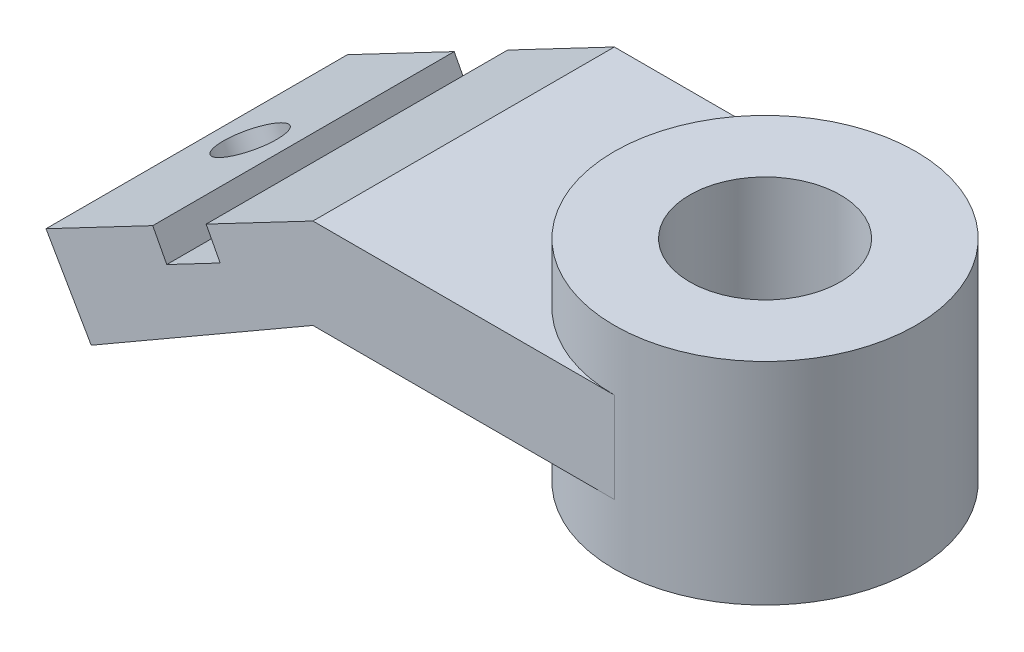
from build123d import *

# Parameters (mm, degrees)
SKETCH1_R           = 25
SKETCH1_R_2         = 12.5
BOSS_EXTRUDE1_DEPTH = 17.5
BOSS_EXTRUDE2_DEPTH = 25
CUT_EXTRUDE1_START  = -50
SKETCH3_R           = 12.5
CUT_EXTRUDE1_DEPTH  = 50
BOSS_EXTRUDE3_DEPTH = 25
SKETCH5_W           = 10
SKETCH5_H           = 75.978198428
CUT_EXTRUDE2_DEPTH  = 5
SKETCH6_R           = 5
CUT_EXTRUDE3_DEPTH  = 101.657736852


with BuildPart() as part:
    # Sketch1 → Boss-Extrude1 (new, symmetric)
    with BuildSketch(Plane(origin=(0, 0, 0), x_dir=(1, 0, 0), z_dir=(0, 1, 0))):
        with Locations(Location((0, 0, 0), (0, 0, 270))):
            Circle(SKETCH1_R)
        with Locations(Location((0, 0, 0), (0, 0, 270))):
            Circle(SKETCH1_R_2, mode=Mode.SUBTRACT)
    extrude(amount=BOSS_EXTRUDE1_DEPTH, both=True)

    # Sketch2 → Boss-Extrude2 (add, symmetric)
    with BuildSketch(Plane.XY):
        Polygon((-15, 7.5), (-50, 7.5), (-50, -7.5), (-15, -7.5), (0, -7.5), (0, 7.5), align=None)
    extrude(amount=BOSS_EXTRUDE2_DEPTH, both=True)

    # Sketch3 → Cut-Extrude1 (cut)
    with BuildSketch(Plane(origin=(0, 17.5, 0), x_dir=(1, 0, 0), z_dir=(0, 1, 0)).offset(CUT_EXTRUDE1_START)):
        with Locations(Location((0, 0, 0), (0, 0, 270))):
            Circle(SKETCH3_R)
    extrude(amount=CUT_EXTRUDE1_DEPTH, mode=Mode.SUBTRACT)

    # Sketch4 → Boss-Extrude3 (add, symmetric)
    with BuildSketch(Plane.XY):
        Polygon((-50, 7.5), (-94.271090497, -15.73941794), (-86.771090497, -28.729798997), (-50, -7.5), align=None)
    extrude(amount=BOSS_EXTRUDE3_DEPTH, both=True)

    # Sketch5 → Cut-Extrude2 (cut)
    with BuildSketch(Plane(origin=(-13.887914048, 26.456475856, 0), x_dir=(0.8854218099422688, 0.4647883588027534, 0), z_dir=(-0.4647883588027534, 0.8854218099422688, 0))):
        with Locations((-65.785177806, 0)):
            Rectangle(SKETCH5_W, SKETCH5_H)
    extrude(amount=-CUT_EXTRUDE2_DEPTH, mode=Mode.SUBTRACT)

    # Sketch6 → Cut-Extrude3 (cut, through all)
    with BuildSketch(Plane(origin=(-13.887914048, 26.456475856, 0), x_dir=(0.8854218099422688, 0.4647883588027534, 0), z_dir=(-0.4647883588027534, 0.8854218099422688, 0))):
        with Locations(Location((-80.785177806, 0, 0), (0, 0, 180))):
            Circle(SKETCH6_R)
    extrude(amount=-CUT_EXTRUDE3_DEPTH, mode=Mode.SUBTRACT)


solid = part.part
